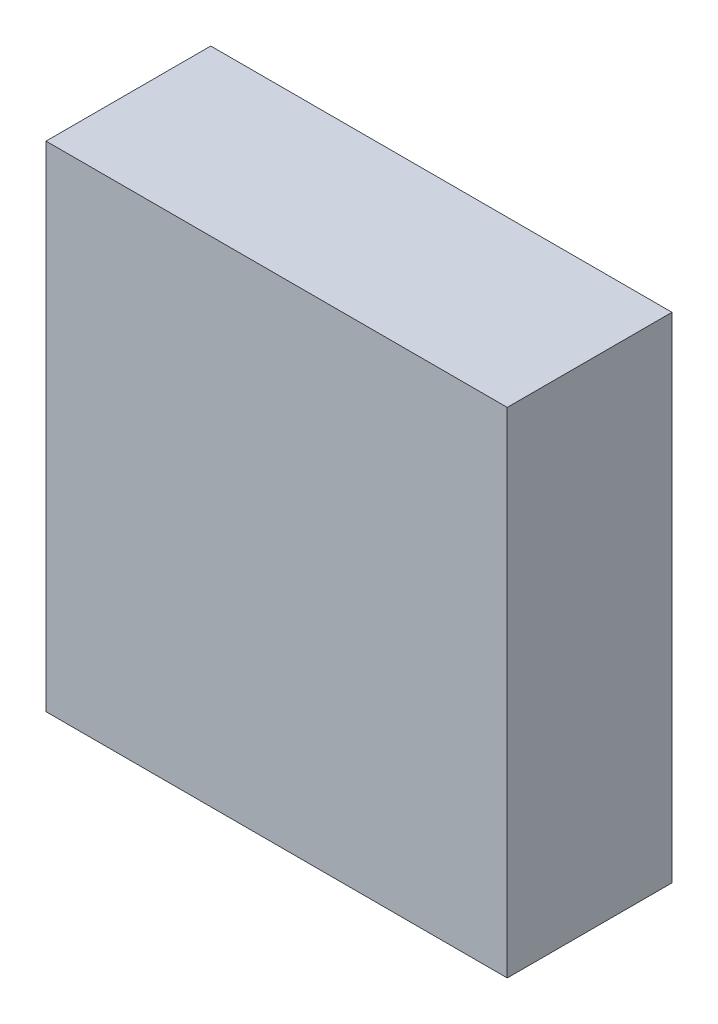
from build123d import *

# Parameters (mm, degrees)
SKETCH1_W               = 2.8
SKETCH1_H               = 3
COMPONENT_OUTLINE_DEPTH = 1


with BuildPart() as part:
    # Sketch1 → Component_Outline (new body)
    with BuildSketch(Plane.XY):
        Rectangle(SKETCH1_W, SKETCH1_H)
    extrude(amount=COMPONENT_OUTLINE_DEPTH)


solid = part.part
